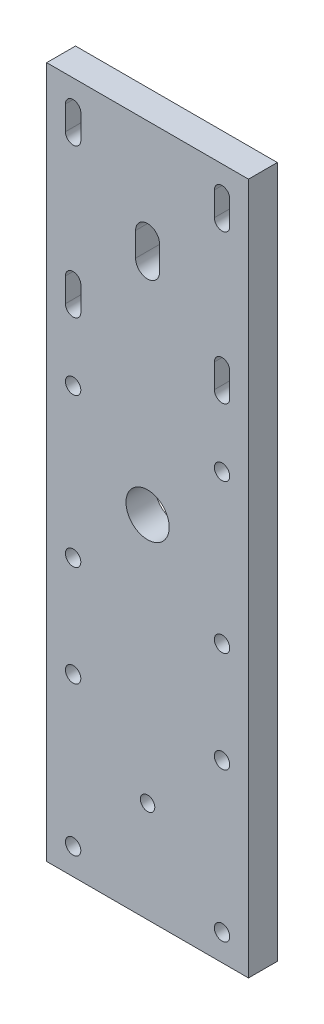
from build123d import *

# Parameters (mm, degrees)
SKETCH_1_W      = 42
SKETCH_1_H      = 3
SKETCH_1_H_2    = 42
SKETCH_1_R      = 1.6
SKETCH_1_R_2    = 4.5
SKETCH_1_H_3    = 10
EXTRUDE_1_DEPTH = 6


with BuildPart() as part:
    # 草图1 → 凸台-拉伸1 (new body)
    # profile 1 of 18: a face of its own
    with BuildSketch(Plane.XY):
        with Locations((0, 43.5)):
            Rectangle(SKETCH_1_W, SKETCH_1_H)
    # profile 2 of 18: a face of its own
    with BuildSketch(Plane.XY):
        with BuildLine():
            Line((21, 92), (-21, 92))
            Line((-21, 92), (-16.63137085, 87.63137085))
            ThreePointArc((-16.63137085, 87.63137085), (-15.129338595, 88.056473618), (-13.980131585, 87))
            Line((-13.980131585, 87), (13.980131585, 87))
            ThreePointArc((13.980131585, 87), (15.5, 88.1), (17.019868415, 87))
            Line((17.019868415, 87), (21, 87))
            Line((21, 87), (21, 92))
        make_face()
    # profile 3 of 18: a face of its own
    with BuildSketch(Plane.XY):
        with BuildLine():
            Line((-21, 92), (-21, 87))
            Line((-21, 87), (-17.019868415, 87))
            ThreePointArc((-17.019868415, 87), (-16.862690243, 87.338495857), (-16.63137085, 87.63137085))
            Line((-16.63137085, 87.63137085), (-21, 92))
        make_face()
    # profile 4 of 18: a face of its own
    with BuildSketch(Plane.XY):
        with BuildLine():
            Line((-17.019868415, 87), (-21, 87))
            Line((-21, 87), (-17.1, 83.1))
            Line((-17.1, 83.1), (-17.1, 86.5))
            ThreePointArc((-17.1, 86.5), (-17.079840097, 86.753190181), (-17.019868415, 87))
        make_face()
    # profile 5 of 18: a face of its own
    with BuildSketch(Plane.XY):
        with BuildLine():
            Line((13.980131585, 87), (-13.980131585, 87))
            ThreePointArc((-13.980131585, 87), (-13.920159903, 86.753190181), (-13.9, 86.5))
            Line((-13.9, 86.5), (-13.9, 84.9))
            Line((-13.9, 84.9), (-1.767766953, 72.767766953))
            ThreePointArc((-1.767766953, 72.767766953), (0.956708581, 73.309698831), (2.5, 71))
            Line((2.5, 71), (2.5, 68.5))
            Line((2.5, 68.5), (14.36862915, 56.63137085))
            ThreePointArc((14.36862915, 56.63137085), (16.112293492, 56.978207252), (17.1, 55.5))
            Line((17.1, 55.5), (17.1, 53.9))
            Line((17.1, 53.9), (21, 50))
            Line((21, 50), (21, 87))
            Line((21, 87), (17.019868415, 87))
            ThreePointArc((17.019868415, 87), (17.079840097, 86.753190181), (17.1, 86.5))
            Line((17.1, 86.5), (17.1, 81.5))
            ThreePointArc((17.1, 81.5), (15.5, 79.9), (13.9, 81.5))
            Line((13.9, 81.5), (13.9, 86.5))
            ThreePointArc((13.9, 86.5), (13.920159903, 86.753190181), (13.980131585, 87))
        make_face()
    # profile 6 of 18: a face of its own
    with BuildSketch(Plane.XY):
        with BuildLine():
            ThreePointArc((-13.9, 81.5), (-14.021792748, 80.887706508), (-14.36862915, 80.36862915))
            Line((-14.36862915, 80.36862915), (-2.5, 68.5))
            Line((-2.5, 68.5), (-2.5, 71))
            ThreePointArc((-2.5, 71), (-2.309698831, 71.956708581), (-1.767766953, 72.767766953))
            Line((-1.767766953, 72.767766953), (-13.9, 84.9))
            Line((-13.9, 84.9), (-13.9, 81.5))
        make_face()
    # profile 7 of 18: a face of its own
    with BuildSketch(Plane.XY):
        with BuildLine():
            Line((-17.1, 83.1), (-21, 87))
            Line((-21, 87), (-21, 50))
            Line((-21, 50), (-17.019868415, 50))
            ThreePointArc((-17.019868415, 50), (-17.079840097, 50.246809819), (-17.1, 50.5))
            Line((-17.1, 50.5), (-17.1, 55.5))
            ThreePointArc((-17.1, 55.5), (-15.5, 57.1), (-13.9, 55.5))
            Line((-13.9, 55.5), (-13.9, 50.5))
            ThreePointArc((-13.9, 50.5), (-13.920159903, 50.246809819), (-13.980131585, 50))
            Line((-13.980131585, 50), (13.980131585, 50))
            ThreePointArc((13.980131585, 50), (13.920159903, 50.246809819), (13.9, 50.5))
            Line((13.9, 50.5), (13.9, 52.1))
            Line((13.9, 52.1), (1.767766953, 64.232233047))
            ThreePointArc((1.767766953, 64.232233047), (-0.956708581, 63.690301169), (-2.5, 66))
            Line((-2.5, 66), (-2.5, 68.5))
            Line((-2.5, 68.5), (-14.36862915, 80.36862915))
            ThreePointArc((-14.36862915, 80.36862915), (-16.112293492, 80.021792748), (-17.1, 81.5))
            Line((-17.1, 81.5), (-17.1, 83.1))
        make_face()
    # profile 8 of 18: a face of its own
    with BuildSketch(Plane.XY):
        with BuildLine():
            ThreePointArc((2.5, 66), (2.309698831, 65.043291419), (1.767766953, 64.232233047))
            Line((1.767766953, 64.232233047), (13.9, 52.1))
            Line((13.9, 52.1), (13.9, 55.5))
            ThreePointArc((13.9, 55.5), (14.021792748, 56.112293492), (14.36862915, 56.63137085))
            Line((14.36862915, 56.63137085), (2.5, 68.5))
            Line((2.5, 68.5), (2.5, 66))
        make_face()
    # profile 9 of 18: a face of its own
    with BuildSketch(Plane.XY):
        with BuildLine():
            Line((17.019868415, 50), (21, 50))
            Line((21, 50), (17.1, 53.9))
            Line((17.1, 53.9), (17.1, 50.5))
            ThreePointArc((17.1, 50.5), (17.079840097, 50.246809819), (17.019868415, 50))
        make_face()
    # profile 10 of 18: a face of its own
    with BuildSketch(Plane.XY):
        with BuildLine():
            Line((16.63137085, 49.36862915), (21, 45))
            Line((21, 45), (21, 50))
            Line((21, 50), (17.019868415, 50))
            ThreePointArc((17.019868415, 50), (16.862690243, 49.661504143), (16.63137085, 49.36862915))
        make_face()
    # profile 11 of 18: a face of its own
    with BuildSketch(Plane.XY):
        with BuildLine():
            Line((-17.019868415, 50), (-21, 50))
            Line((-21, 50), (-21, 45))
            Line((-21, 45), (21, 45))
            Line((21, 45), (16.63137085, 49.36862915))
            ThreePointArc((16.63137085, 49.36862915), (15.129338595, 48.943526382), (13.980131585, 50))
            Line((13.980131585, 50), (-13.980131585, 50))
            ThreePointArc((-13.980131585, 50), (-15.5, 48.9), (-17.019868415, 50))
        make_face()
    # profile 12 of 18: a face of its own
    with BuildSketch(Plane.XY):
        with Locations((0, 43.5)):
            Rectangle(SKETCH_1_W, SKETCH_1_H)
    # profile 13 of 18: a face of its own
    with BuildSketch(Plane.XY):
        with Locations((0, 21)):
            Rectangle(SKETCH_1_W, SKETCH_1_H_2)
        with Locations((-15.5, 5.5)):
            Circle(SKETCH_1_R, mode=Mode.SUBTRACT)
        with Locations((15.5, 5.5)):
            Circle(SKETCH_1_R, mode=Mode.SUBTRACT)
        with Locations((-15.5, 36.5)):
            Circle(SKETCH_1_R, mode=Mode.SUBTRACT)
        with Locations((0, 21)):
            Circle(SKETCH_1_R_2, mode=Mode.SUBTRACT)
        with Locations((15.5, 36.5)):
            Circle(SKETCH_1_R, mode=Mode.SUBTRACT)
    # profile 14 of 18: a face of its own
    with BuildSketch(Plane.XY):
        with Locations((0, -5)):
            Rectangle(SKETCH_1_W, SKETCH_1_H_3)
    # profile 15 of 18: a face of its own
    with BuildSketch(Plane.XY):
        with BuildLine():
            Line((21, -10), (-21, -10))
            Line((-21, -10), (-16.63137085, -14.36862915))
            ThreePointArc((-16.63137085, -14.36862915), (-14.887706508, -14.021792748), (-13.9, -15.5))
            ThreePointArc((-13.9, -15.5), (-14.021792748, -16.112293492), (-14.36862915, -16.63137085))
            Line((-14.36862915, -16.63137085), (-1.060660172, -29.939339828))
            ThreePointArc((-1.060660172, -29.939339828), (0, -29.5), (1.060660172, -29.939339828))
            Line((1.060660172, -29.939339828), (14.36862915, -16.63137085))
            ThreePointArc((14.36862915, -16.63137085), (14.36862915, -14.36862915), (16.63137085, -14.36862915))
            Line((16.63137085, -14.36862915), (21, -10))
        make_face()
    # profile 16 of 18: a face of its own
    with BuildSketch(Plane.XY):
        with BuildLine():
            Line((-16.63137085, -14.36862915), (-21, -10))
            Line((-21, -10), (-21, -52))
            Line((-21, -52), (-16.63137085, -47.63137085))
            ThreePointArc((-16.63137085, -47.63137085), (-16.63137085, -45.36862915), (-14.36862915, -45.36862915))
            Line((-14.36862915, -45.36862915), (-1.060660172, -32.060660172))
            ThreePointArc((-1.060660172, -32.060660172), (-1.5, -31), (-1.060660172, -29.939339828))
            Line((-1.060660172, -29.939339828), (-14.36862915, -16.63137085))
            ThreePointArc((-14.36862915, -16.63137085), (-16.63137085, -16.63137085), (-16.63137085, -14.36862915))
        make_face()
    # profile 17 of 18: a face of its own
    with BuildSketch(Plane.XY):
        with BuildLine():
            Line((-16.63137085, -47.63137085), (-21, -52))
            Line((-21, -52), (21, -52))
            Line((21, -52), (16.63137085, -47.63137085))
            ThreePointArc((16.63137085, -47.63137085), (14.36862915, -47.63137085), (14.36862915, -45.36862915))
            Line((14.36862915, -45.36862915), (1.060660172, -32.060660172))
            ThreePointArc((1.060660172, -32.060660172), (0, -32.5), (-1.060660172, -32.060660172))
            Line((-1.060660172, -32.060660172), (-14.36862915, -45.36862915))
            ThreePointArc((-14.36862915, -45.36862915), (-14.021792748, -45.887706508), (-13.9, -46.5))
            ThreePointArc((-13.9, -46.5), (-14.887706508, -47.978207252), (-16.63137085, -47.63137085))
        make_face()
    # profile 18 of 18: a face of its own
    with BuildSketch(Plane.XY):
        with BuildLine():
            Line((21, -52), (21, -10))
            Line((21, -10), (16.63137085, -14.36862915))
            ThreePointArc((16.63137085, -14.36862915), (16.978207252, -14.887706508), (17.1, -15.5))
            ThreePointArc((17.1, -15.5), (16.112293492, -16.978207252), (14.36862915, -16.63137085))
            Line((14.36862915, -16.63137085), (1.060660172, -29.939339828))
            ThreePointArc((1.060660172, -29.939339828), (1.385819299, -30.425974851), (1.5, -31))
            ThreePointArc((1.5, -31), (1.385819299, -31.574025149), (1.060660172, -32.060660172))
            Line((1.060660172, -32.060660172), (14.36862915, -45.36862915))
            ThreePointArc((14.36862915, -45.36862915), (16.112293492, -45.021792748), (17.1, -46.5))
            ThreePointArc((17.1, -46.5), (16.978207252, -47.112293492), (16.63137085, -47.63137085))
            Line((16.63137085, -47.63137085), (21, -52))
        make_face()
    extrude(amount=EXTRUDE_1_DEPTH)


solid = part.part
